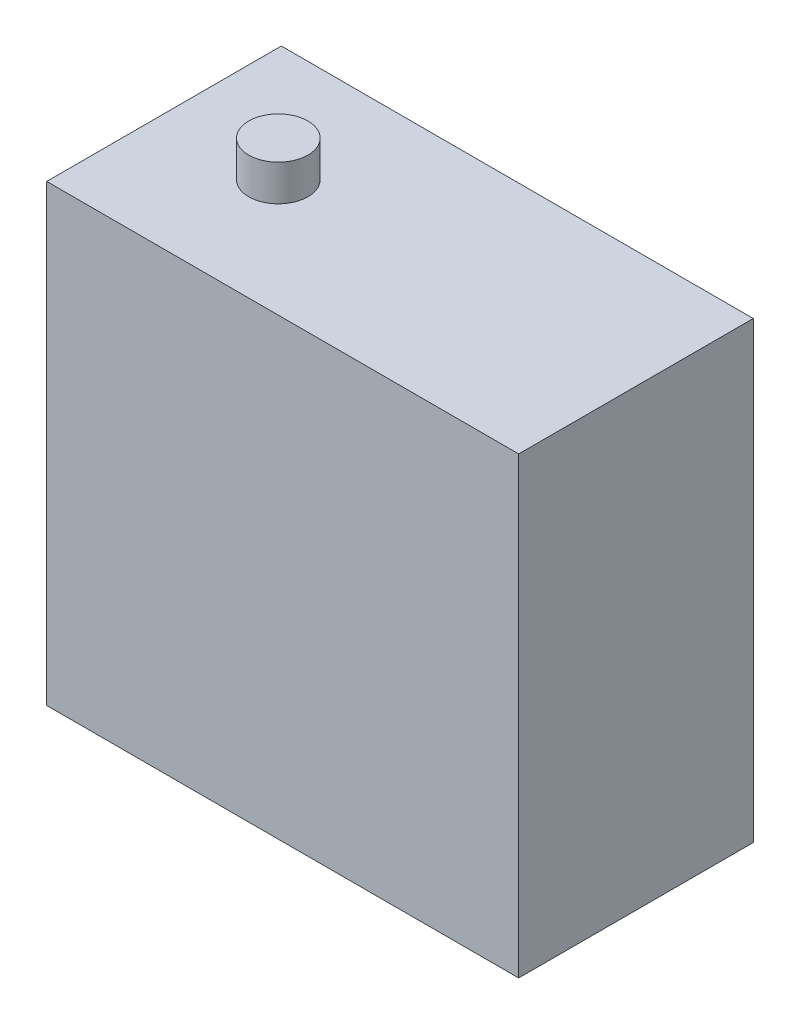
from build123d import *

# Parameters (mm, degrees)
SKETCH1_W           = 39.88
SKETCH1_H           = 19.82
BOSS_EXTRUDE1_DEPTH = 38.35
SKETCH2_R           = 2.5
BOSS_EXTRUDE2_DEPTH = 3.05


with BuildPart() as part:
    # Sketch1 → Boss-Extrude1 (new body)
    with BuildSketch(Plane(origin=(0, 0, 0), x_dir=(1, 0, 0), z_dir=(0, 1, 0))):
        with Locations((19.94, 9.91)):
            Rectangle(SKETCH1_W, SKETCH1_H)
    extrude(amount=BOSS_EXTRUDE1_DEPTH)

    # Sketch2 → Boss-Extrude2 (add)
    with BuildSketch(Plane(origin=(0, 38.35, 0), x_dir=(1, 0, 0), z_dir=(0, 1, 0))):
        with Locations(Location((9.66, 9.91, 0), (0, 0, 90))):
            Circle(SKETCH2_R)
    extrude(amount=BOSS_EXTRUDE2_DEPTH)


solid = part.part
